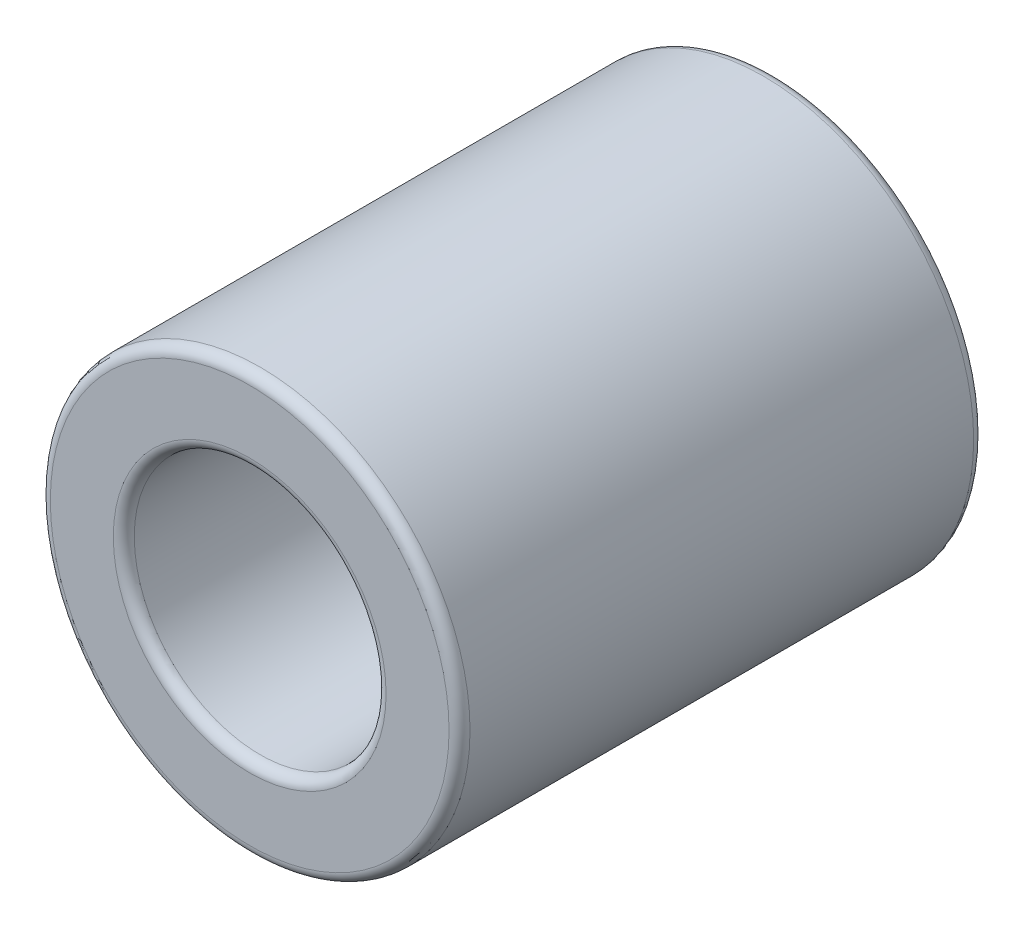
from build123d import *

# Parameters (mm, degrees)
SKETCH_1_R          = 10
EXTRUDE_1_DEPTH     = 25
SKETCH_2_R          = 6
CUT_EXTRUDE_1_DEPTH = 12.5
SKETCH_3_R          = 3
CUT_EXTRUDE_2_DEPTH = 15
FILLET_1_R          = 0.5


with BuildPart() as part:
    # 草图1 → 凸台-拉伸1 (new body)
    with BuildSketch(Plane.XY):
        Circle(SKETCH_1_R)
    extrude(amount=EXTRUDE_1_DEPTH)

    # 草图2 → 切除-拉伸1 (cut)
    with BuildSketch(Plane.XY.offset(25)):
        Circle(SKETCH_2_R)
    extrude(amount=-CUT_EXTRUDE_1_DEPTH, mode=Mode.SUBTRACT)

    # 草图3 → 切除-拉伸2 (cut)
    with BuildSketch(Plane(origin=(0, 0, 0), x_dir=(-1, 0, 0), z_dir=(0, 0, -1))):
        Circle(SKETCH_3_R)
    extrude(amount=-CUT_EXTRUDE_2_DEPTH, mode=Mode.SUBTRACT)

    # 圆角1
    fillet_1_edges = [part.edges().sort_by_distance(p)[0] for p in [
        (3, 0, 0),
        (-10, 0, 0),
        (-10, 0, 25),
        (-6, 0, 25),
    ]]
    fillet(fillet_1_edges, radius=FILLET_1_R)


solid = part.part
